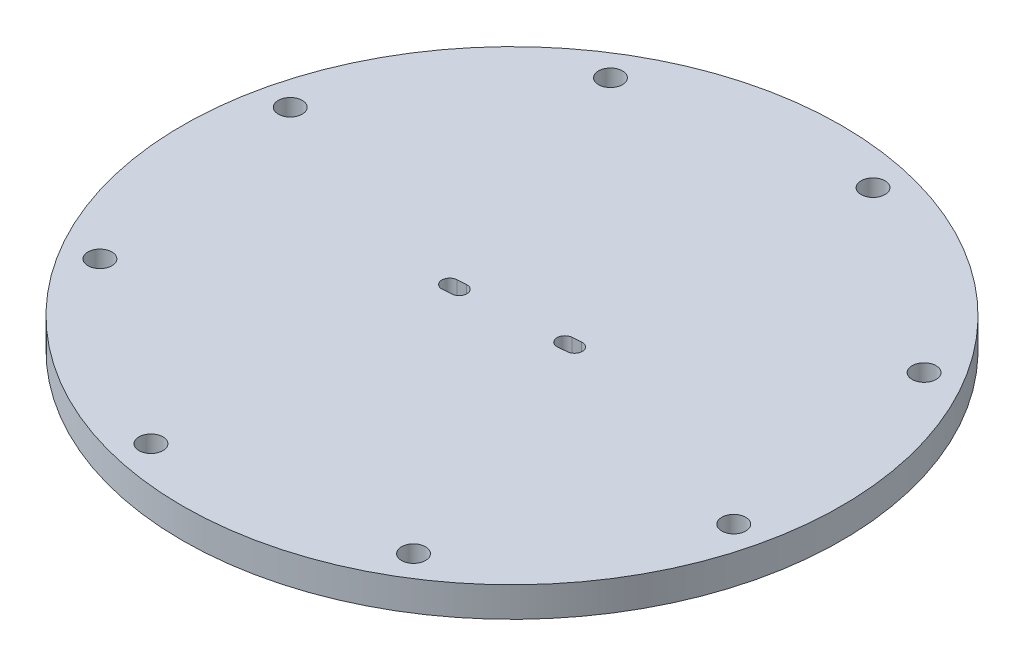
from build123d import *

# Parameters (mm, degrees)
CROQUIS1_R              = 110
SALIENTE_EXTRUIR1_DEPTH = 10
CORTAR_EXTRUIR2_DEPTH   = 156.884572681
CROQUIS5_R              = 4
CORTAR_EXTRUIR3_DEPTH   = 156.884572681


with BuildPart() as part:
    # Croquis1 → Saliente-Extruir1 (new body)
    with BuildSketch(Plane(origin=(0, 0, 0), x_dir=(1, 0, 0), z_dir=(0, 1, 0))):
        with Locations(Location((0, 0, 0), (0, 0, 270))):
            Circle(CROQUIS1_R)
    extrude(amount=SALIENTE_EXTRUIR1_DEPTH)

    # Croquis3 → Cortar-Extruir2 (cut, through all)
    with BuildSketch(Plane(origin=(0, 10, 0), x_dir=(1, 0, 0), z_dir=(0, 1, 0))):
        with BuildLine():
            Line((-19.635517807, 1.200433086), (-16.643149179, 1.41427881))
            ThreePointArc((-16.643149179, 1.41427881), (-13.867597162, -0.991029758), (-16.27290573, -3.766581775))
            Line((-16.27290573, -3.766581775), (-19.265274358, -3.980427499))
            ThreePointArc((-19.265274358, -3.980427499), (-22.040826375, -1.575118931), (-19.635517807, 1.200433086))
        make_face()
        with BuildLine():
            Line((16.244753287, 3.783863744), (19.237121915, 4.028597389))
            ThreePointArc((19.237121915, 4.028597389), (22.058108344, 1.634159295), (19.66367025, -1.186827134))
            Line((19.66367025, -1.186827134), (16.671301622, -1.431560779))
            ThreePointArc((16.671301622, -1.431560779), (13.850315193, 0.962877315), (16.244753287, 3.783863744))
        make_face()
    extrude(amount=-CORTAR_EXTRUIR2_DEPTH, mode=Mode.SUBTRACT)

    # Croquis5 → Cortar-Extruir3 (cut, through all)
    with BuildSketch(Plane(origin=(0, 10, 0), x_dir=(1, 0, 0), z_dir=(0, 1, 0))):
        with Locations(Location((-85.209654188, -52.338464184, 0), (0, 0, 270))):
            Circle(CROQUIS5_R)
        with Locations(Location((-97.26120724, 23.243441358, 0), (0, 0, 270))):
            Circle(CROQUIS5_R)
        with Locations(Location((-52.338464184, 85.209654188, 0), (0, 0, 270))):
            Circle(CROQUIS5_R)
        with Locations(Location((23.243441358, 97.26120724, 0), (0, 0, 270))):
            Circle(CROQUIS5_R)
        with Locations(Location((85.209654188, 52.338464184, 0), (0, 0, 270))):
            Circle(CROQUIS5_R)
        with Locations(Location((97.26120724, -23.243441358, 0), (0, 0, 270))):
            Circle(CROQUIS5_R)
        with Locations(Location((52.338464184, -85.209654188, 0), (0, 0, 270))):
            Circle(CROQUIS5_R)
        with Locations(Location((-23.243441358, -97.26120724, 0), (0, 0, 270))):
            Circle(CROQUIS5_R)
    extrude(amount=-CORTAR_EXTRUIR3_DEPTH, mode=Mode.SUBTRACT)


solid = part.part
